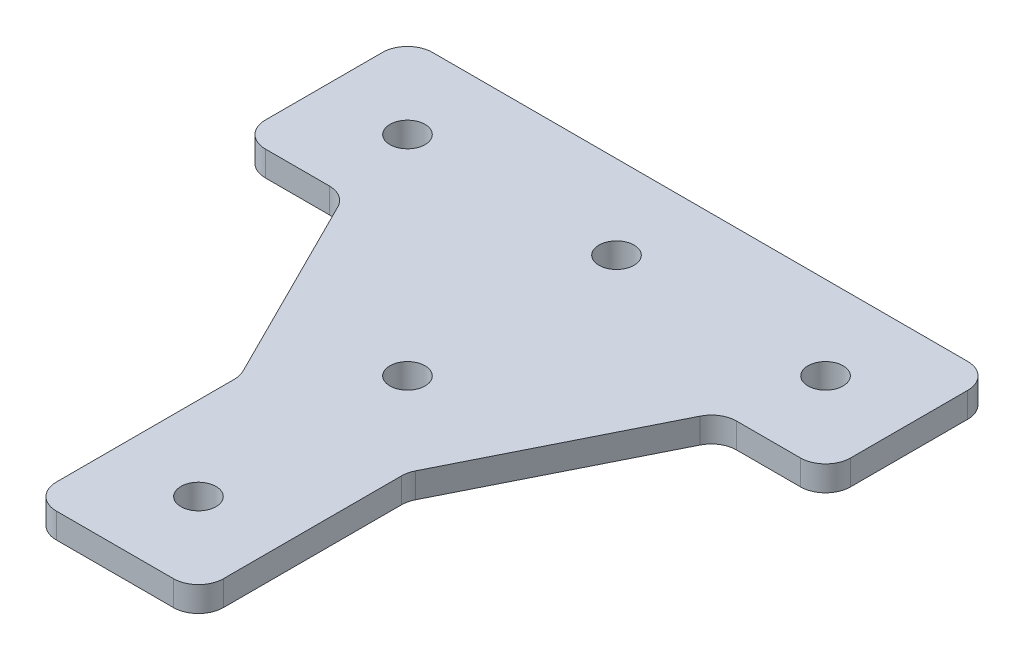
from build123d import *

# Parameters (mm, degrees)
SKETCH_1_R      = 2.1
EXTRUDE_1_DEPTH = 3
FILLET_1_R      = 3


with BuildPart() as part:
    # 草图1 → 凸台-拉伸1 (new body)
    # profile 1 of 3: a face of its own
    with BuildSketch(Plane(origin=(0, 0, 0), x_dir=(1, 0, 0), z_dir=(0, 1, 0))):
        Polygon((10, -10), (35, -10), (35, 10), (-35, 10), (-35, -10), (-10, -10), (-10, -60), (10, -60), align=None)
        with Locations(Location((0, -50, 0), (0, 0, 270))):
            Circle(SKETCH_1_R, mode=Mode.SUBTRACT)
        with Locations(Location((0, -25, 0), (0, 0, 270))):
            Circle(SKETCH_1_R, mode=Mode.SUBTRACT)
        with Locations(Location((-25, 0, 0), (0, 0, 270))):
            Circle(SKETCH_1_R, mode=Mode.SUBTRACT)
        with Locations(Location((25, 0, 0), (0, 0, 270))):
            Circle(SKETCH_1_R, mode=Mode.SUBTRACT)
        with Locations(Location((0, 0, 0), (0, 0, 270))):
            Circle(SKETCH_1_R, mode=Mode.SUBTRACT)
    # profile 2 of 3: a face of its own
    with BuildSketch(Plane(origin=(0, 0, 0), x_dir=(1, 0, 0), z_dir=(0, 1, 0))):
        Polygon((-10, -10), (-22.5, -10), (-10, -35), align=None)
    # profile 3 of 3: a face of its own
    with BuildSketch(Plane(origin=(0, 0, 0), x_dir=(1, 0, 0), z_dir=(0, 1, 0))):
        Polygon((10, -35), (22.5, -10), (10, -10), align=None)
    extrude(amount=EXTRUDE_1_DEPTH)

    # 圆角1
    fillet_1_edges = [part.edges().sort_by_distance(p)[0] for p in [
        (10, 1.5, 35),
        (10, 1.5, 60),
        (-10, 1.5, 60),
        (-10, 1.5, 35),
        (-22.5, 1.5, 10),
        (-35, 1.5, 10),
        (-35, 1.5, -10),
        (35, 1.5, -10),
        (35, 1.5, 10),
        (22.5, 1.5, 10),
    ]]
    fillet(fillet_1_edges, radius=FILLET_1_R)


solid = part.part
